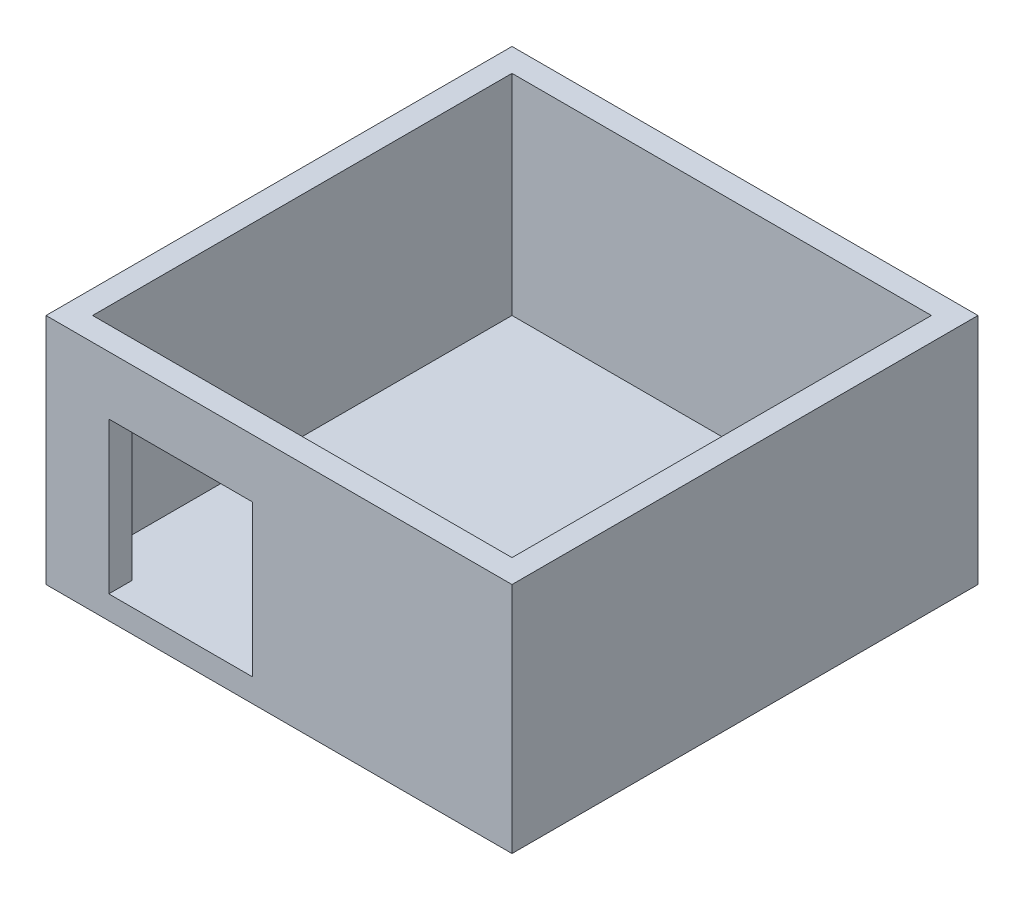
from build123d import *

# Parameters (mm, degrees)
SKETCH4_W           = 40
SKETCH4_H           = 40
BOSS_EXTRUDE3_DEPTH = 20
SHELL7_T            = -2
SKETCH5_W           = 12.32
SKETCH5_H           = 13
CUT_EXTRUDE1_DEPTH  = 2


with BuildPart() as part:
    # Sketch4 → Boss-Extrude3 (new body)
    with BuildSketch(Plane(origin=(0, 0, 0), x_dir=(1, 0, 0), z_dir=(0, 1, 0))):
        Rectangle(SKETCH4_W, SKETCH4_H)
    extrude(amount=BOSS_EXTRUDE3_DEPTH)

    # Shell7
    shell7_openings = [part.faces().sort_by_distance(p)[0] for p in [
        (0, 20, 0),
    ]]
    offset(amount=SHELL7_T, openings=shell7_openings, kind=Kind.INTERSECTION)

    # Sketch5 → Cut-Extrude1 (cut)
    with BuildSketch(Plane.XY.offset(20)):
        with Locations((-8.449687556, 8.5)):
            Rectangle(SKETCH5_W, SKETCH5_H)
    extrude(amount=-CUT_EXTRUDE1_DEPTH, mode=Mode.SUBTRACT)


solid = part.part
